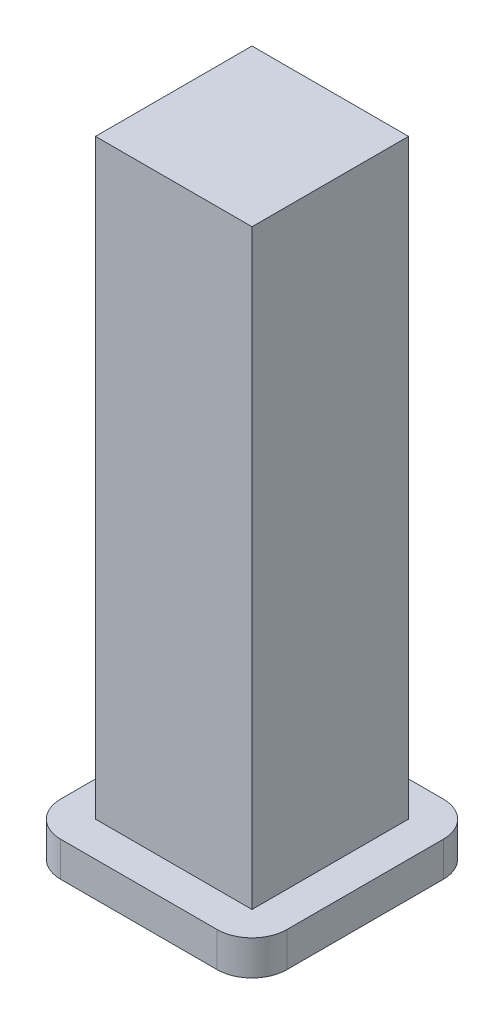
from build123d import *

# Parameters (mm, degrees)
SKETCH1_W           = 45
SKETCH1_H           = 180
BOSS_EXTRUDE1_DEPTH = 45
SKETCH2_W           = 65
SKETCH2_H           = 65
BOSS_EXTRUDE2_DEPTH = 10
FILLET1_R           = 10


with BuildPart() as part:
    # Sketch1 → Boss-Extrude1 (new body)
    with BuildSketch(Plane.XY):
        with Locations((22.5, 90)):
            Rectangle(SKETCH1_W, SKETCH1_H)
    extrude(amount=BOSS_EXTRUDE1_DEPTH)

    # Sketch2 → Boss-Extrude2 (add)
    with BuildSketch(Plane.XZ):
        with Locations((22.5, 22.5)):
            Rectangle(SKETCH2_W, SKETCH2_H)
    extrude(amount=-BOSS_EXTRUDE2_DEPTH)

    # Fillet1
    fillet1_edges = [part.edges().sort_by_distance(p)[0] for p in [
        (-10, 5, -10),
        (-10, 5, 55),
        (55, 5, 55),
        (55, 5, -10),
    ]]
    fillet(fillet1_edges, radius=FILLET1_R)


solid = part.part
